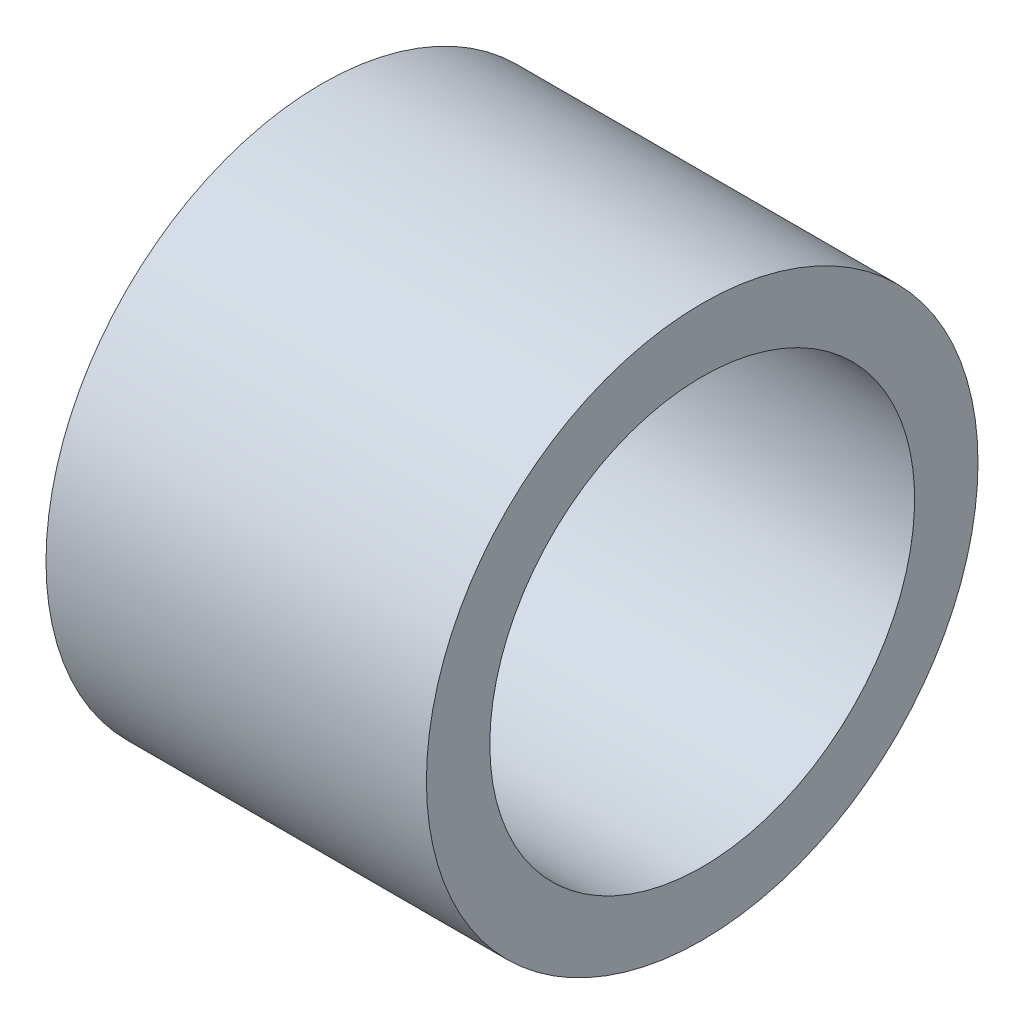
from build123d import *


with BuildPart() as part:
    # Sketch1 → Revolve1 (revolve)
    with BuildSketch(Plane.XY, mode=Mode.PRIVATE) as revolve1_sk:
        Polygon((0, 3), (0, 4.35), (6, 4.35), (6, 3.35), (1, 3.35), (1, 1), (0, 1), (-1, 1), (-1, 2), align=None)
    revolve(revolve1_sk.sketch.rotate(Axis((0, 0, 0), (1, 0, 0)), 90), axis=Axis((0, 0, 0), (1, 0, 0)))


solid = part.part
